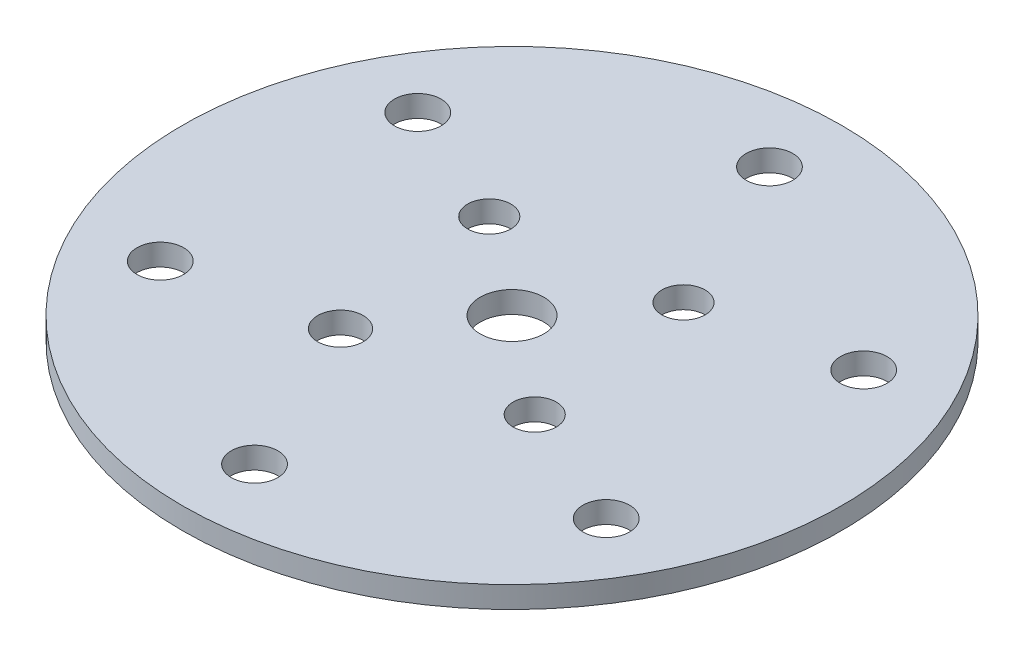
from build123d import *

# Parameters (mm, degrees)
SKETCH1_R           = 30.48
SKETCH1_R_2         = 2.15265
SKETCH1_R_3         = 2.9453237
SKETCH1_R_4         = 2
SKETCH1_R_5         = 2.104990058
BOSS_EXTRUDE1_DEPTH = 2


with BuildPart() as part:
    # Sketch1 → Boss-Extrude1 (new body)
    with BuildSketch(Plane(origin=(0, 0, 0), x_dir=(1, 0, 0), z_dir=(0, 1, 0))):
        with Locations(Location((0, 0, 0), (0, 0, 270))):
            Circle(SKETCH1_R)
        with Locations(Location((0, -23.8125, 0), (0, 0, 270))):
            Circle(SKETCH1_R_2, mode=Mode.SUBTRACT)
        with Locations(Location((20.622229928, -11.90625, 0), (0, 0, 270))):
            Circle(SKETCH1_R_2, mode=Mode.SUBTRACT)
        with Locations(Location((20.622229928, 11.90625, 0), (0, 0, 270))):
            Circle(SKETCH1_R_2, mode=Mode.SUBTRACT)
        with Locations(Location((0, 23.8125, 0), (0, 0, 270))):
            Circle(SKETCH1_R_2, mode=Mode.SUBTRACT)
        with Locations(Location((-20.622229928, 11.90625, 0), (0, 0, 270))):
            Circle(SKETCH1_R_2, mode=Mode.SUBTRACT)
        with Locations(Location((-20.622229928, -11.90625, 0), (0, 0, 270))):
            Circle(SKETCH1_R_2, mode=Mode.SUBTRACT)
        with Locations(Location((0, 0, 0), (0, 0, 270))):
            Circle(SKETCH1_R_3, mode=Mode.SUBTRACT)
        with Locations(Location((-8.981689404, 6.879626113, 0), (0, 0, 270))):
            Circle(SKETCH1_R_4, mode=Mode.SUBTRACT)
        with Locations(Location((6.879626113, 8.981689404, 0), (0, 0, 270))):
            Circle(SKETCH1_R_4, mode=Mode.SUBTRACT)
        with Locations(Location((8.981689404, -6.879626113, 0), (0, 0, 270))):
            Circle(SKETCH1_R_4, mode=Mode.SUBTRACT)
        with Locations(Location((-6.879626113, -8.981689404, 0), (0, 0, 270))):
            Circle(SKETCH1_R_5, mode=Mode.SUBTRACT)
    extrude(amount=BOSS_EXTRUDE1_DEPTH)


solid = part.part
